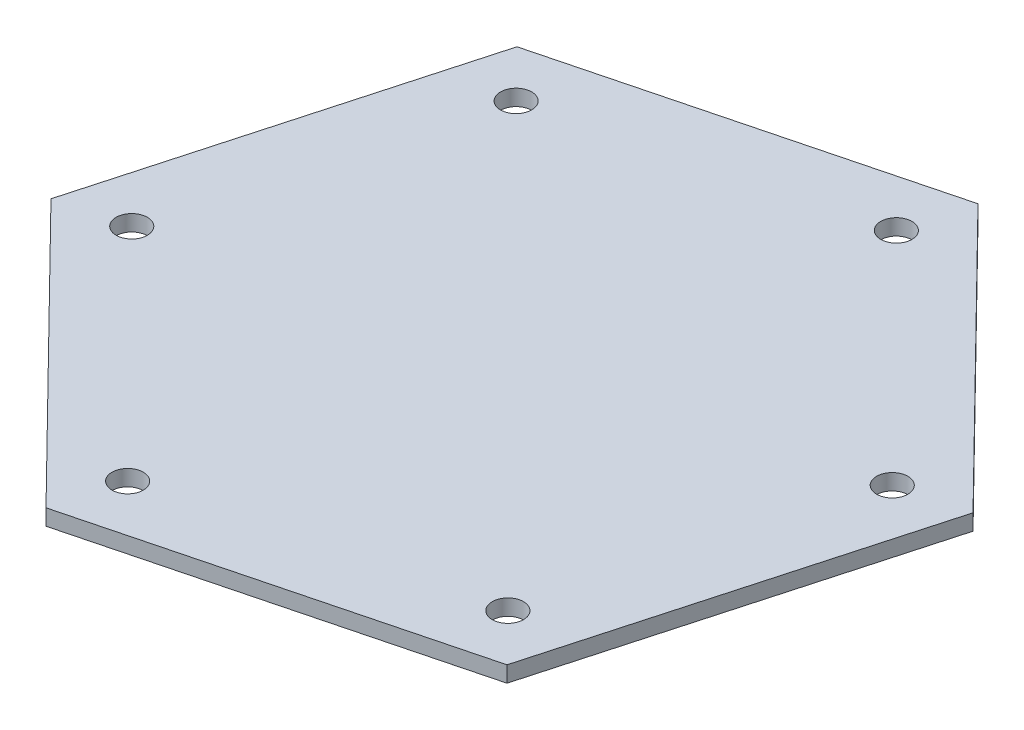
from build123d import *

# Parameters (mm, degrees)
BOSS_EXTRUDE1_DEPTH = 1.3
SKETCH2_R           = 1.27
CUT_EXTRUDE2_DEPTH  = 43.086324906


with BuildPart() as part:
    # Sketch1 → Boss-Extrude1 (new body)
    with BuildSketch(Plane(origin=(0, 0, 0), x_dir=(1, 0, 0), z_dir=(0, 1, 0))):
        Polygon((21.57246336, -21.977580043), (29.819374311, 7.693511271), (8.246910951, 29.671091314), (-21.57246336, 21.977580043), (-29.819374311, -7.693511271), (-8.246910951, -29.671091314), align=None)
    extrude(amount=BOSS_EXTRUDE1_DEPTH)

    # Sketch2 → Cut-Extrude2 (cut, through all)
    with BuildSketch(Plane(origin=(0, 0, 0), x_dir=(1, 0, 0), z_dir=(0, 1, 0))):
        with Locations(Location((6.801937511, 24.472303653, 0), (0, 0, 270))):
            Circle(SKETCH2_R)
        with Locations(Location((24.594605408, 6.345501147, 0), (0, 0, 270))):
            Circle(SKETCH2_R)
        with Locations(Location((17.792667898, -18.126802506, 0), (0, 0, 270))):
            Circle(SKETCH2_R)
        with Locations(Location((-6.801937511, -24.472303653, 0), (0, 0, 270))):
            Circle(SKETCH2_R)
        with Locations(Location((-24.594605408, -6.345501147, 0), (0, 0, 270))):
            Circle(SKETCH2_R)
        with Locations(Location((-17.792667898, 18.126802506, 0), (0, 0, 270))):
            Circle(SKETCH2_R)
    extrude(amount=CUT_EXTRUDE2_DEPTH, mode=Mode.SUBTRACT)


solid = part.part
